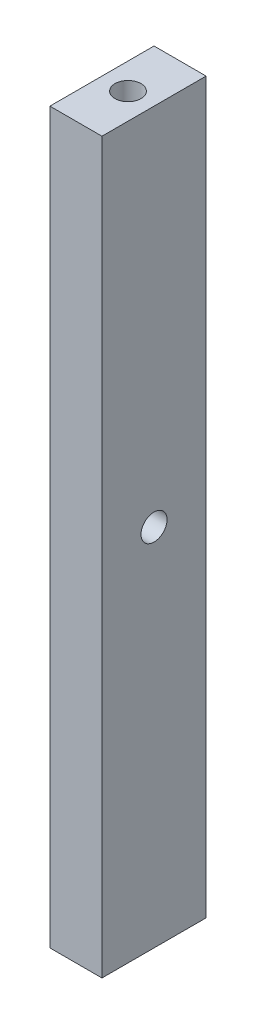
from build123d import *

# Parameters (mm, degrees)
SKETCH1_W           = 50.8
SKETCH1_H           = 101.6
BOSS_EXTRUDE1_DEPTH = 711.2
SKETCH2_R           = 12.7
CUT_EXTRUDE1_DEPTH  = 50.8
SKETCH3_R           = 12.7
CUT_EXTRUDE2_DEPTH  = 152.4
CUT_EXTRUDE3_START  = -152.4
SKETCH4_R           = 12.7
CUT_EXTRUDE3_DEPTH  = 152.4


with BuildPart() as part:
    # Sketch1 → Boss-Extrude1 (new body)
    with BuildSketch(Plane(origin=(0, 0, 0), x_dir=(1, 0, 0), z_dir=(0, 1, 0))):
        with Locations((25.4, -50.8)):
            Rectangle(SKETCH1_W, SKETCH1_H)
    extrude(amount=-BOSS_EXTRUDE1_DEPTH)

    # Sketch2 → Cut-Extrude1 (cut)
    with BuildSketch(Plane.ZY):
        with Locations((50.8, -355.6)):
            Circle(SKETCH2_R)
    extrude(amount=-CUT_EXTRUDE1_DEPTH, mode=Mode.SUBTRACT)

    # Sketch3 → Cut-Extrude2 (cut)
    with BuildSketch(Plane(origin=(0, 0, 0), x_dir=(1, 0, 0), z_dir=(0, 1, 0))):
        with Locations(Location((25.4, -50.8, 0), (0, 0, 270))):
            Circle(SKETCH3_R)
    extrude(amount=-CUT_EXTRUDE2_DEPTH, mode=Mode.SUBTRACT)

    # Sketch4 → Cut-Extrude3 (cut)
    with BuildSketch(Plane.XZ.offset(711.2).offset(CUT_EXTRUDE3_START)):
        with Locations(Location((25.4, 50.8, 0), (0, 0, 90))):
            Circle(SKETCH4_R)
    extrude(amount=CUT_EXTRUDE3_DEPTH, mode=Mode.SUBTRACT)


solid = part.part
